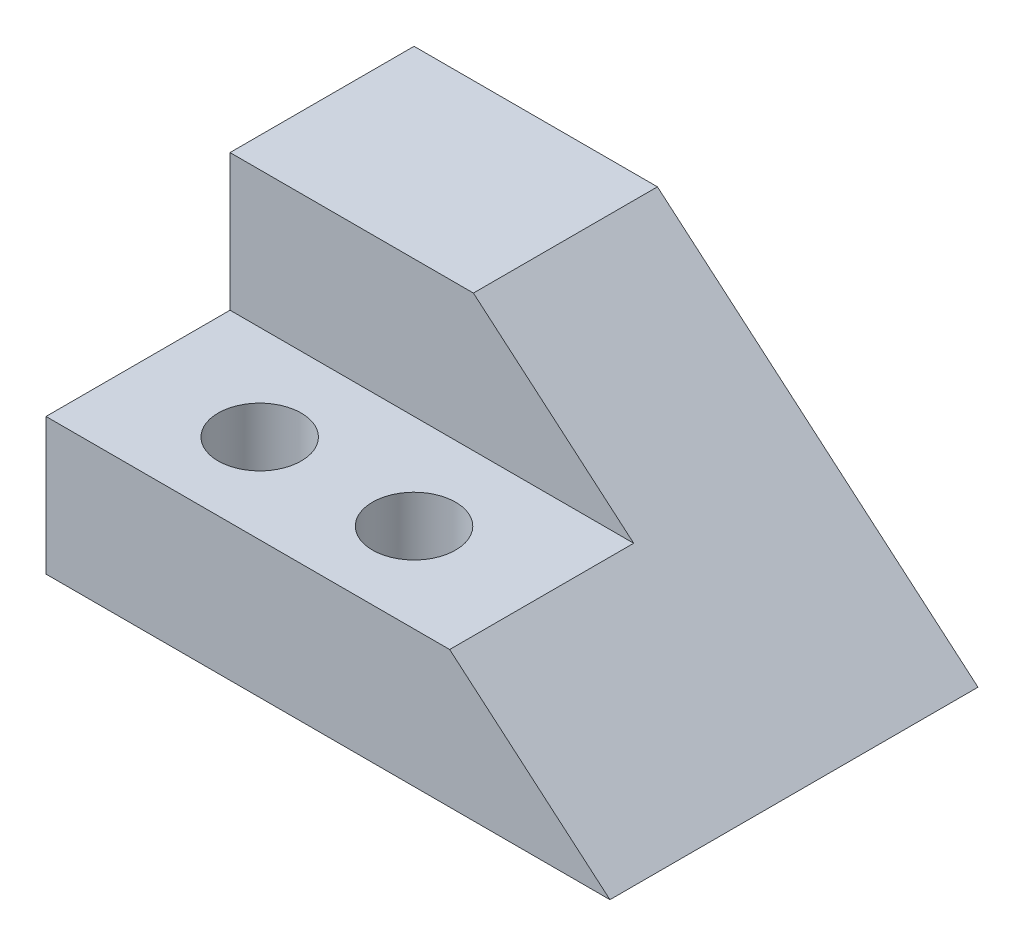
from build123d import *

# Parameters (mm, degrees)
EXTRUDE_1_DEPTH     = 62
SKETCH_2_W          = 31
SKETCH_2_H          = 23
CUT_EXTRUDE_1_DEPTH = 70
SKETCH_3_R          = 7
CUT_EXTRUDE_2_DEPTH = 62


with BuildPart() as part:
    # 스케치1 → 보스-돌출1 (new body)
    with BuildSketch(Plane.XY):
        Polygon((0, 0), (95, 0), (41, 46), (0, 46), align=None)
    extrude(amount=-EXTRUDE_1_DEPTH)

    # 스케치2 → 컷-돌출1 (cut)
    with BuildSketch(Plane.ZY):
        with Locations((-15.5, 34.5)):
            Rectangle(SKETCH_2_W, SKETCH_2_H)
    extrude(amount=-CUT_EXTRUDE_1_DEPTH, mode=Mode.SUBTRACT)

    # 스케치3 → 컷-돌출2 (cut)
    with BuildSketch(Plane(origin=(0, 23, 0), x_dir=(1, 0, 0), z_dir=(0, 1, 0))):
        with Locations(Location((21, 15, 0), (0, 0, 270))):
            Circle(SKETCH_3_R)
        with Locations(Location((47, 15, 0), (0, 0, 270))):
            Circle(SKETCH_3_R)
    extrude(amount=-CUT_EXTRUDE_2_DEPTH, mode=Mode.SUBTRACT)


solid = part.part
